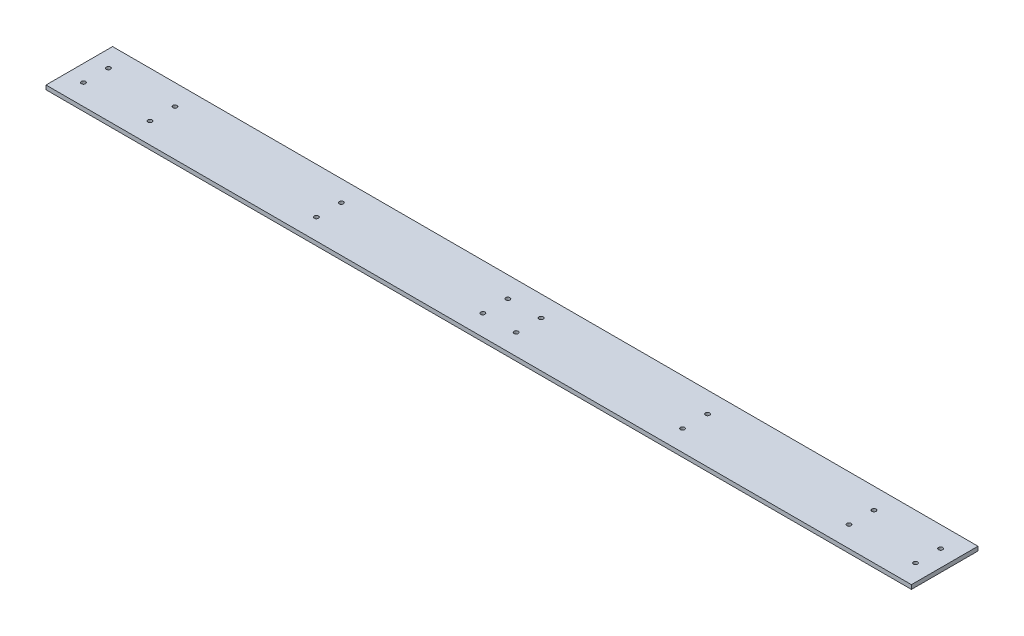
from build123d import *

# Parameters (mm, degrees)
SKETCH1_W           = 1040
SKETCH1_H           = 80
SKETCH1_R           = 2.5
BOSS_EXTRUDE2_DEPTH = 5


with BuildPart() as part:
    # Sketch1 → Boss-Extrude2 (new body)
    with BuildSketch(Plane(origin=(0, 0, 0), x_dir=(1, 0, 0), z_dir=(0, 1, 0))):
        with Locations((20, 0)):
            Rectangle(SKETCH1_W, SKETCH1_H)
        with Locations(Location((0, 15, 0), (0, 0, 270))):
            Circle(SKETCH1_R, mode=Mode.SUBTRACT)
        with Locations(Location((0, -15, 0), (0, 0, 270))):
            Circle(SKETCH1_R, mode=Mode.SUBTRACT)
        with Locations(Location((40, 15, 0), (0, 0, 270))):
            Circle(SKETCH1_R, mode=Mode.SUBTRACT)
        with Locations(Location((40, -15, 0), (0, 0, 270))):
            Circle(SKETCH1_R, mode=Mode.SUBTRACT)
        with Locations(Location((-200, 15, 0), (0, 0, 270))):
            Circle(SKETCH1_R, mode=Mode.SUBTRACT)
        with Locations(Location((-200, -15, 0), (0, 0, 270))):
            Circle(SKETCH1_R, mode=Mode.SUBTRACT)
        with Locations(Location((240, -15, 0), (0, 0, 270))):
            Circle(SKETCH1_R, mode=Mode.SUBTRACT)
        with Locations(Location((240, 15, 0), (0, 0, 270))):
            Circle(SKETCH1_R, mode=Mode.SUBTRACT)
        with Locations(Location((-400, 15, 0), (0, 0, 270))):
            Circle(SKETCH1_R, mode=Mode.SUBTRACT)
        with Locations(Location((-400, -15, 0), (0, 0, 270))):
            Circle(SKETCH1_R, mode=Mode.SUBTRACT)
        with Locations(Location((440, -15, 0), (0, 0, 270))):
            Circle(SKETCH1_R, mode=Mode.SUBTRACT)
        with Locations(Location((440, 15, 0), (0, 0, 270))):
            Circle(SKETCH1_R, mode=Mode.SUBTRACT)
        with Locations(Location((520, 15, 0), (0, 0, 270))):
            Circle(SKETCH1_R, mode=Mode.SUBTRACT)
        with Locations(Location((520, -15, 0), (0, 0, 270))):
            Circle(SKETCH1_R, mode=Mode.SUBTRACT)
        with Locations(Location((-480, 15, 0), (0, 0, 270))):
            Circle(SKETCH1_R, mode=Mode.SUBTRACT)
        with Locations(Location((-480, -15, 0), (0, 0, 270))):
            Circle(SKETCH1_R, mode=Mode.SUBTRACT)
    extrude(amount=BOSS_EXTRUDE2_DEPTH)


solid = part.part
